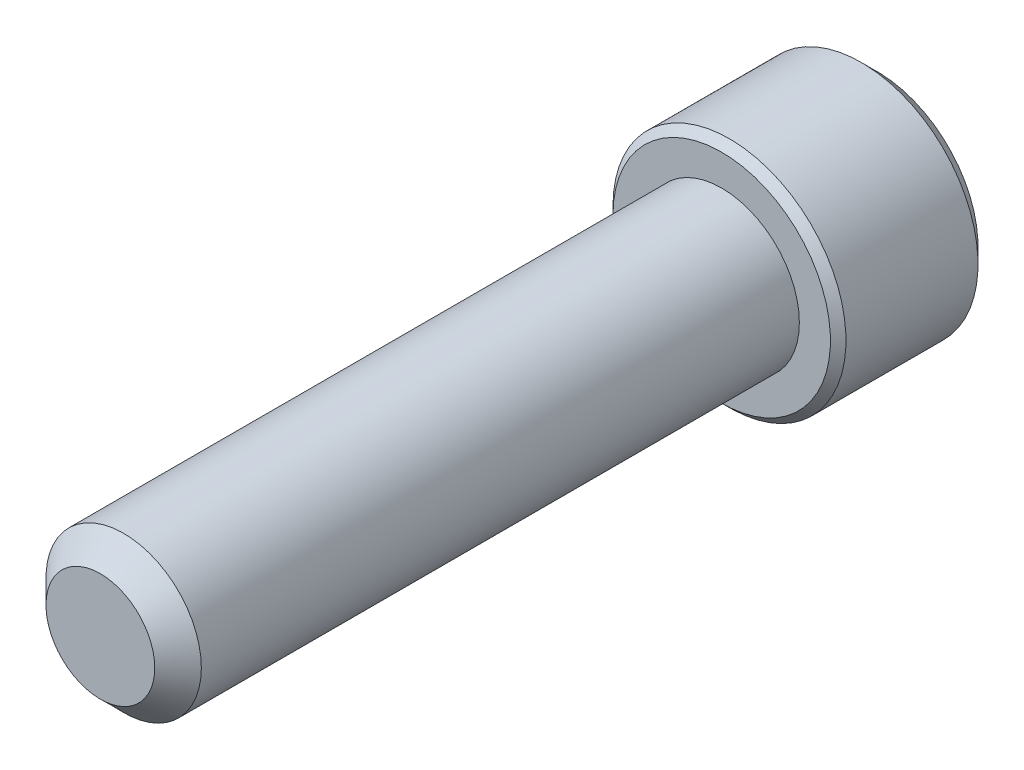
from build123d import *

# Parameters (mm, degrees)
SKETCH1_R          = 3.175
EXTRUDE1_DEPTH     = 25.4
CHAMFER3_SIZE      = 0.9525
SKETCH6_R          = 4.7625
EXTRUDE2_DEPTH     = 6.35
CUT_EXTRUDE1_DEPTH = 3.571875
SKETCH8_R          = 2.749630657
CUT_EXTRUDE2_DEPTH = 0.635
CUT_EXTRUDE2_DRAFT = -45
CHAMFER1_SIZE      = 0.635
CHAMFER2_SIZE      = 0.3175


with BuildPart() as part:
    # Sketch1 → Extrude1 (new body)
    with BuildSketch(Plane.XY):
        Circle(SKETCH1_R)
    extrude(amount=-EXTRUDE1_DEPTH)

    # Chamfer3
    chamfer3_edges = [part.edges().sort_by_distance(p)[0] for p in [
        (-3.175, 0, 0),
    ]]
    chamfer(chamfer3_edges, length=CHAMFER3_SIZE)

    # Sketch6 → Extrude2 (add)
    with BuildSketch(Plane(origin=(0, 0, -25.4), x_dir=(-1, 0, 0), z_dir=(0, 0, -1))):
        Circle(SKETCH6_R)
    extrude(amount=EXTRUDE2_DEPTH)

    # Sketch7 → Cut-Extrude1 (cut)
    with BuildSketch(Plane(origin=(0, 0, -31.75), x_dir=(-1, 0, 0), z_dir=(0, 0, -1))):
        Polygon((0, 2.749630657), (-2.38125, 1.374815329), (-2.38125, -1.374815329), (0, -2.749630657), (2.38125, -1.374815329), (2.38125, 1.374815329), align=None)
    extrude(amount=-CUT_EXTRUDE1_DEPTH, mode=Mode.SUBTRACT)


with BuildPart() as cut_extrude2_tool:
    # Sketch8 → Cut-Extrude2 (with draft: the straight prism first)
    with BuildSketch(Plane(origin=(0, 0, -31.75), x_dir=(-1, 0, 0), z_dir=(0, 0, -1))):
        Circle(SKETCH8_R)
    extrude(amount=-CUT_EXTRUDE2_DEPTH)
    # Cut-Extrude2: the draft: its side faces are tilted about the plane it starts from
    cut_extrude2_sides = [cut_extrude2_tool.faces().sort_by_distance(p)[0] for p in [
        (2.749630657, 0, -31.4325),
    ]]
    draft(cut_extrude2_sides, Plane(origin=(0, 0, -31.75), x_dir=(-1, 0, 0), z_dir=(0, 0, -1)), CUT_EXTRUDE2_DRAFT)


with BuildPart() as part_1:
    add(part.part)

    # Cut-Extrude2: cut by cut_extrude2_tool
    add(cut_extrude2_tool.part, mode=Mode.SUBTRACT)

    # Chamfer1
    chamfer1_edges = [part_1.edges().sort_by_distance(p)[0] for p in [
        (4.7625, 0, -31.75),
    ]]
    chamfer(chamfer1_edges, length=CHAMFER1_SIZE)

    # Chamfer2
    chamfer2_edges = [part_1.edges().sort_by_distance(p)[0] for p in [
        (4.7625, 0, -25.4),
    ]]
    chamfer(chamfer2_edges, length=CHAMFER2_SIZE)


solid = part_1.part
